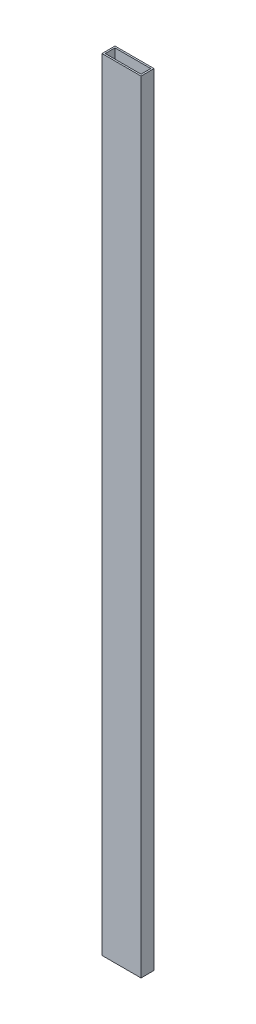
from build123d import *

# Parameters (mm, degrees)
SKETCH1_W           = 76.2
SKETCH1_H           = 25.4
SKETCH1_W_2         = 69.85
SKETCH1_H_2         = 19.05
BOSS_EXTRUDE1_DEPTH = 1524


with BuildPart() as part:
    # Sketch1 → Boss-Extrude1 (new body)
    with BuildSketch(Plane(origin=(0, 0, 0), x_dir=(1, 0, 0), z_dir=(0, 1, 0))):
        with Locations((-38.1, 12.7)):
            Rectangle(SKETCH1_W, SKETCH1_H)
        with Locations((-38.1, 12.7)):
            Rectangle(SKETCH1_W_2, SKETCH1_H_2, mode=Mode.SUBTRACT)
    extrude(amount=BOSS_EXTRUDE1_DEPTH)


solid = part.part
